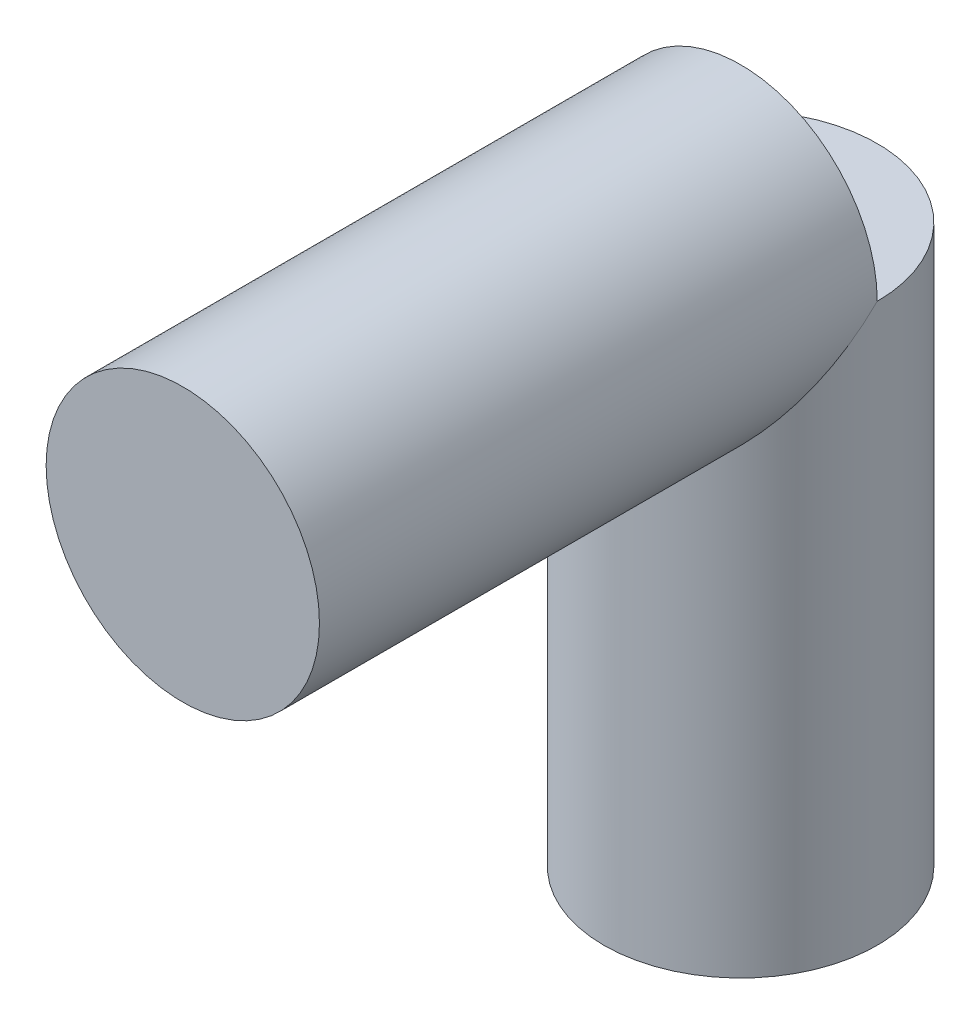
from build123d import *

# Parameters (mm, degrees)
SKETCH1_R           = 4.9
BOSS_EXTRUDE1_DEPTH = 20
SKETCH3_R           = 4.9
BOSS_EXTRUDE2_DEPTH = 20


with BuildPart() as part:
    # Sketch1 → Boss-Extrude1 (new body)
    with BuildSketch(Plane(origin=(0, 0, 0), x_dir=(1, 0, 0), z_dir=(0, 1, 0))):
        with Locations(Location((0, 0, 0), (0, 0, 270))):
            Circle(SKETCH1_R)
    extrude(amount=BOSS_EXTRUDE1_DEPTH)

    # Sketch3 → Boss-Extrude2 (add)
    with BuildSketch(Plane.XY):
        with Locations((0, 20)):
            Circle(SKETCH3_R)
    extrude(amount=BOSS_EXTRUDE2_DEPTH)


solid = part.part
